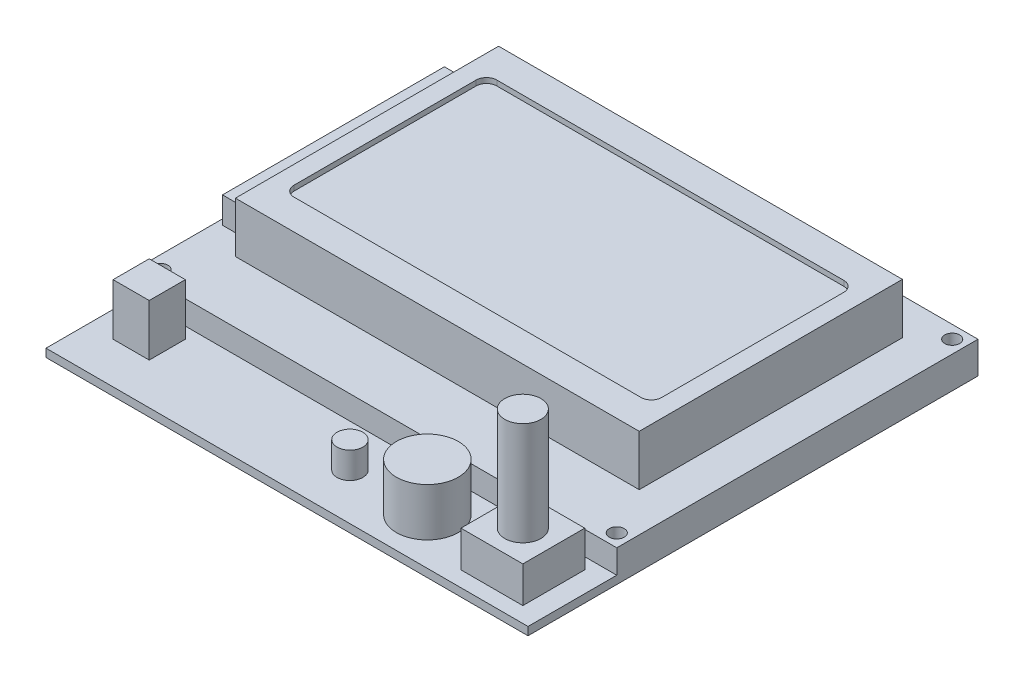
from build123d import *

# Parameters (mm, degrees)
SKETCH1_W            = 93.4
SKETCH1_H            = 87.2
SKETCH1_R            = 1.45
BOSS_EXTRUDE2_DEPTH  = 1.57
BOSS_EXTRUDE3_START  = 4.6
SKETCH1_3_W          = 93.4
SKETCH1_3_H          = 70
SKETCH1_3_R          = 1.45
BOSS_EXTRUDE3_DEPTH  = 4.6
SKETCH1_4_W          = 78.25
SKETCH1_4_H          = 51
BOSS_EXTRUDE4_DEPTH  = 14.4
SKETCH1_5_W          = 6.5
SKETCH1_5_H          = 43
BOSS_EXTRUDE5_DEPTH  = 9.7
SKETCH1_6_W          = 12
SKETCH1_6_H          = 12
BOSS_EXTRUDE6_DEPTH  = 7
SKETCH1_7_R          = 3.5
BOSS_EXTRUDE7_DEPTH  = 27
SKETCH1_8_R          = 6
BOSS_EXTRUDE8_DEPTH  = 9.3
SKETCH1_9_R          = 2.5
BOSS_EXTRUDE9_DEPTH  = 5.1
SKETCH3_W            = 26.26
SKETCH3_H            = 26.47
BOSS_EXTRUDE10_DEPTH = 4
SKETCH4_W            = 20.28
SKETCH4_H            = 9
BOSS_EXTRUDE11_DEPTH = 20
CUT_EXTRUDE1_DEPTH   = 1
SKETCH6_W            = 26.47
SKETCH6_H            = 4
CUT_EXTRUDE2_DEPTH   = 1
SKETCH7_W            = 7
SKETCH7_H            = 7
BOSS_EXTRUDE12_DEPTH = 10


with BuildPart() as part:
    # Sketch1 → Boss-Extrude2 (new body)
    with BuildSketch(Plane(origin=(0, 0, 0), x_dir=(1, 0, 0), z_dir=(0, 1, 0))):
        Rectangle(SKETCH1_W, SKETCH1_H)
        with Locations((-44.2, -23.9)):
            Circle(SKETCH1_R, mode=Mode.SUBTRACT)
        with Locations((44.2, -23.9)):
            Circle(SKETCH1_R, mode=Mode.SUBTRACT)
        with Locations((-44.2, 41.1)):
            Circle(SKETCH1_R, mode=Mode.SUBTRACT)
        with Locations((44.2, 41.1)):
            Circle(SKETCH1_R, mode=Mode.SUBTRACT)
    extrude(amount=-BOSS_EXTRUDE2_DEPTH)

    # Sketch1<3> → Boss-Extrude3 (add)
    with BuildSketch(Plane(origin=(0, 0, 0), x_dir=(1, 0, 0), z_dir=(0, 1, 0)).offset(BOSS_EXTRUDE3_START)):
        with Locations((0, 8.6)):
            Rectangle(SKETCH1_3_W, SKETCH1_3_H)
        with Locations((-44.2, -23.9)):
            Circle(SKETCH1_3_R, mode=Mode.SUBTRACT)
        with Locations((44.2, -23.9)):
            Circle(SKETCH1_3_R, mode=Mode.SUBTRACT)
        with Locations((-44.2, 41.1)):
            Circle(SKETCH1_3_R, mode=Mode.SUBTRACT)
        with Locations((44.2, 41.1)):
            Circle(SKETCH1_3_R, mode=Mode.SUBTRACT)
    extrude(amount=-BOSS_EXTRUDE3_DEPTH)

    # Sketch1<4> → Boss-Extrude4 (add)
    with BuildSketch(Plane(origin=(0, 0, 0), x_dir=(1, 0, 0), z_dir=(0, 1, 0))):
        with Locations((0, 11.027837259)):
            Rectangle(SKETCH1_4_W, SKETCH1_4_H)
    extrude(amount=BOSS_EXTRUDE4_DEPTH)

    # Sketch1<5> → Boss-Extrude5 (add)
    with BuildSketch(Plane(origin=(0, 0, 0), x_dir=(1, 0, 0), z_dir=(0, 1, 0))):
        with Locations((-42.375, 11.027837259)):
            Rectangle(SKETCH1_5_W, SKETCH1_5_H)
    extrude(amount=BOSS_EXTRUDE5_DEPTH)

    # Sketch1<6> → Boss-Extrude6 (add)
    with BuildSketch(Plane(origin=(0, 0, 0), x_dir=(1, 0, 0), z_dir=(0, 1, 0))):
        with Locations((36.7, -34.6)):
            Rectangle(SKETCH1_6_W, SKETCH1_6_H)
    extrude(amount=BOSS_EXTRUDE6_DEPTH)

    # Sketch1<7> → Boss-Extrude7 (add)
    with BuildSketch(Plane(origin=(0, 0, 0), x_dir=(1, 0, 0), z_dir=(0, 1, 0))):
        with Locations((36.7, -34.6)):
            Circle(SKETCH1_7_R)
    extrude(amount=BOSS_EXTRUDE7_DEPTH)

    # Sketch1<8> → Boss-Extrude8 (add)
    with BuildSketch(Plane(origin=(0, 0, 0), x_dir=(1, 0, 0), z_dir=(0, 1, 0))):
        with Locations((18.2, -34.6)):
            Circle(SKETCH1_8_R)
    extrude(amount=BOSS_EXTRUDE8_DEPTH)

    # Sketch1<9> → Boss-Extrude9 (add)
    with BuildSketch(Plane(origin=(0, 0, 0), x_dir=(1, 0, 0), z_dir=(0, 1, 0))):
        with Locations((3.2, -34.6)):
            Circle(SKETCH1_9_R)
    extrude(amount=BOSS_EXTRUDE9_DEPTH)

    # Sketch3 → Boss-Extrude10 (add)
    with BuildSketch(Plane.XZ.offset(1.57)):
        with Locations((-33.57, -8.405)):
            Rectangle(SKETCH3_W, SKETCH3_H)
    extrude(amount=BOSS_EXTRUDE10_DEPTH)

    # Sketch4 → Boss-Extrude11 (add)
    with BuildSketch(Plane.XZ.offset(1.57)):
        with Locations((-15.18, -32.7)):
            Rectangle(SKETCH4_W, SKETCH4_H)
        with Locations((15.44, -32.7)):
            Rectangle(SKETCH4_W, SKETCH4_H)
    extrude(amount=BOSS_EXTRUDE11_DEPTH)

    # Sketch5 → Cut-Extrude1 (cut)
    with BuildSketch(Plane(origin=(0, 14.4, 0), x_dir=(1, 0, 0), z_dir=(0, 1, 0))):
        with BuildLine():
            Line((33.625, 30.677837259), (-33.625, 30.677837259))
            ThreePointArc((-33.625, 30.677837259), (-35.039213562, 30.092050821), (-35.625, 28.677837259))
            Line((-35.625, 28.677837259), (-35.625, -6.622162741))
            ThreePointArc((-35.625, -6.622162741), (-35.039213562, -8.036376303), (-33.625, -8.622162741))
            Line((-33.625, -8.622162741), (33.625, -8.622162741))
            ThreePointArc((33.625, -8.622162741), (35.039213562, -8.036376303), (35.625, -6.622162741))
            Line((35.625, -6.622162741), (35.625, 28.677837259))
            ThreePointArc((35.625, 28.677837259), (35.039213562, 30.092050821), (33.625, 30.677837259))
        make_face()
    extrude(amount=-CUT_EXTRUDE1_DEPTH, mode=Mode.SUBTRACT)

    # Sketch6 → Cut-Extrude2 (cut)
    with BuildSketch(Plane.ZY.offset(46.7)):
        with Locations((-8.405, -3.57)):
            Rectangle(SKETCH6_W, SKETCH6_H)
    extrude(amount=-CUT_EXTRUDE2_DEPTH, mode=Mode.SUBTRACT)

    # Sketch7 → Boss-Extrude12 (add)
    with BuildSketch(Plane(origin=(0, 0, 0), x_dir=(1, 0, 0), z_dir=(0, 1, 0))):
        with Locations((-38.2, -32.1)):
            Rectangle(SKETCH7_W, SKETCH7_H)
    extrude(amount=BOSS_EXTRUDE12_DEPTH)


solid = part.part
